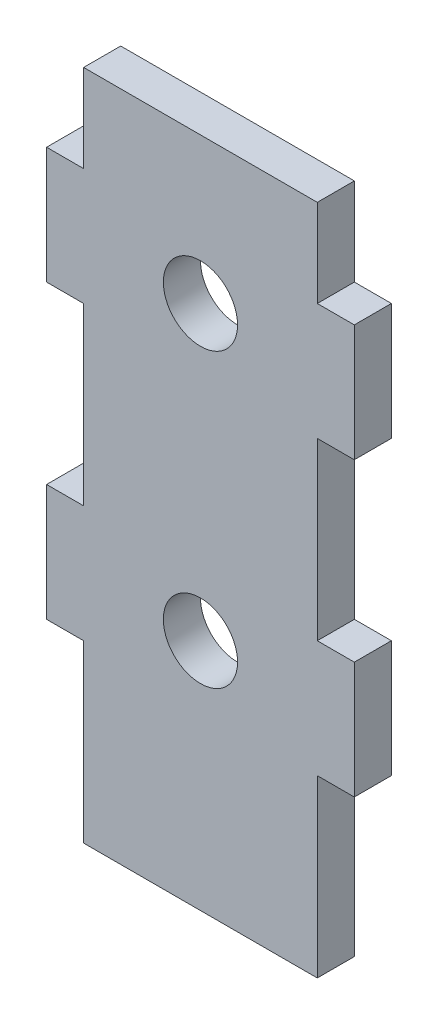
from build123d import *

# Parameters (mm, degrees)
BOSS_EXTRUDE1_DEPTH     = 6.35
CUT_EXTRUDE1_DEPTH      = 119.1487118
CUT_EXTRUDE1_DEPTH_BACK = 119.1487118
SKETCH3_R               = 6.35


with BuildPart() as part:
    # Sketch1 → Boss-Extrude1 (new body)
    with BuildSketch(Plane.XY):
        Polygon((-20, 0), (20, 0), (20, 30), (26.34, 30), (26.34, 50), (20, 50), (20, 80), (26.34, 80), (26.34, 100), (20, 100), (20, 115), (-20, 115), (-20, 100), (-26.34, 100), (-26.34, 80), (-20, 80), (-20, 50), (-26.34, 50), (-26.34, 30), (-20, 30), align=None)
    extrude(amount=BOSS_EXTRUDE1_DEPTH)

    # Sketch3 → Cut-Extrude1 (cut, two sides: drawn at the far end of the back side and taken through both)
    with BuildSketch(Plane.XY.offset(6.35).offset(-CUT_EXTRUDE1_DEPTH_BACK)):
        with Locations((0, 90)):
            Circle(SKETCH3_R)
        with Locations((0, 40)):
            Circle(SKETCH3_R)
    extrude(amount=CUT_EXTRUDE1_DEPTH + CUT_EXTRUDE1_DEPTH_BACK, mode=Mode.SUBTRACT)


solid = part.part
